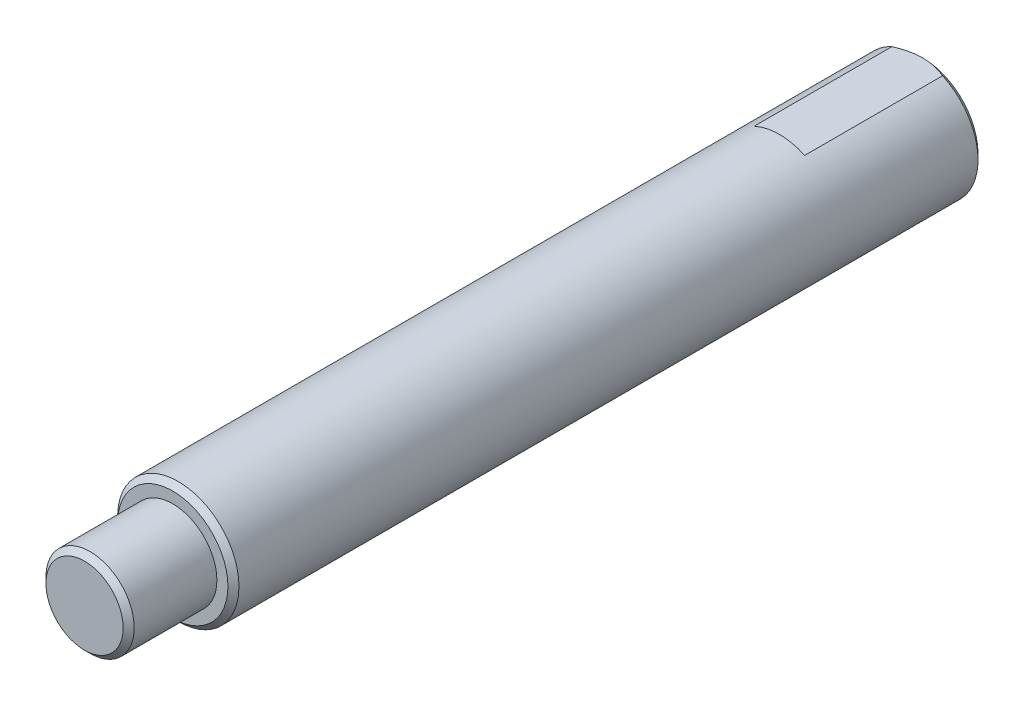
from build123d import *
from build123d.topology import SkipClean

# Parameters (mm, degrees)
SKETCH_1_R             = 5.5
EXTRUDE_1_DEPTH        = 68
CHAMFER_1_SIZE         = 0.5
SKETCH_2_R             = 4
EXTRUDE_2_DEPTH        = 8
CHAMFER_2_SIZE         = 0.5
HOLE_WIZARD_M5_1_D     = 4.2
HOLE_WIZARD_M5_1_DEPTH = 12.4
HOLE_WIZARD_M5_1_TIP   = 1.2618073
CHAMFER_3_SIZE         = 0.5
SKETCH_5_W             = 10
SKETCH_5_H             = 3
CUT_EXTRUDE_3_DEPTH    = 13


with BuildPart() as part:
    # 草图1 → 拉伸1 (new body)
    with BuildSketch(Plane.XY):
        Circle(SKETCH_1_R)
    extrude(amount=EXTRUDE_1_DEPTH)

    # 倒角1
    chamfer_1_edges = [part.edges().sort_by_distance(p)[0] for p in [
        (-5.5, 0, 0),
        (-5.5, 0, 68),
    ]]
    chamfer(chamfer_1_edges, length=CHAMFER_1_SIZE)

    # 草图2 → 拉伸2 (add)
    with BuildSketch(Plane.XY.offset(68)):
        Circle(SKETCH_2_R)
    extrude(amount=EXTRUDE_2_DEPTH)

    # 倒角2
    chamfer_2_edges = [part.edges().sort_by_distance(p)[0] for p in [
        (-4, 0, 76),
    ]]
    chamfer(chamfer_2_edges, length=CHAMFER_2_SIZE)

    # M5 螺纹孔1
    with Locations(Plane(origin=(0, 0, 0), x_dir=(-1, 0, 0), z_dir=(0, 0, -1))):
        with Locations((0, 0)):
            Hole(HOLE_WIZARD_M5_1_D / 2, depth=HOLE_WIZARD_M5_1_DEPTH)
            with Locations((0, 0, -(HOLE_WIZARD_M5_1_DEPTH + HOLE_WIZARD_M5_1_TIP / 2))):  # 118° drill point
                Cone(0, HOLE_WIZARD_M5_1_D / 2, HOLE_WIZARD_M5_1_TIP, mode=Mode.SUBTRACT)

    # 倒角3
    chamfer_3_edges = [part.edges().sort_by_distance(p)[0] for p in [
        (-2.1, 0, 0),
    ]]
    chamfer(chamfer_3_edges, length=CHAMFER_3_SIZE)

    # 草图5 → 拉伸3 (cut)
    with SkipClean():  # the faces are left unmerged after this step: merging them gives an invalid solid
        with BuildSketch(Plane.XY):
            with Locations((0, 6.5)):
                Rectangle(SKETCH_5_W, SKETCH_5_H)
        cut_extrude_3 = extrude(amount=CUT_EXTRUDE_3_DEPTH, mode=Mode.SUBTRACT)

    # 镜向1: 拉伸3 across plane
    add(cut_extrude_3.mirror(Plane.ZX), mode=Mode.SUBTRACT)


solid = part.part
